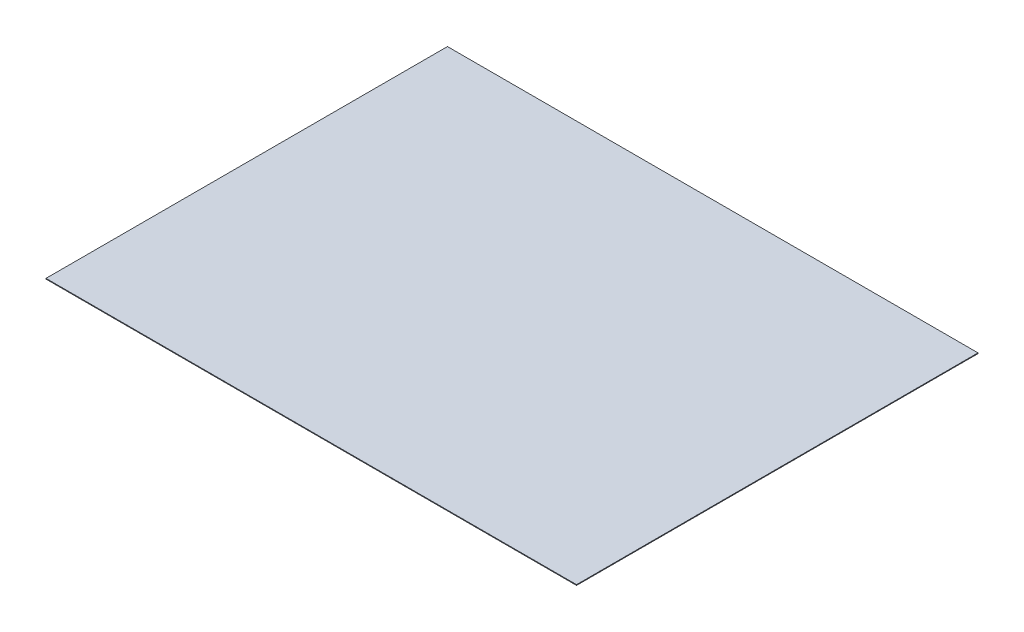
from build123d import *

# Parameters (mm, degrees)
CROQUIS1_W     = 1533
CROQUIS1_H     = 1160
EXTRUIR1_DEPTH = 2


with BuildPart() as part:
    # Croquis1 → Extruir1 (new body)
    with BuildSketch(Plane(origin=(0, 0, 0), x_dir=(1, 0, 0), z_dir=(0, 1, 0))):
        Rectangle(CROQUIS1_W, CROQUIS1_H)
    extrude(amount=EXTRUIR1_DEPTH)


solid = part.part
